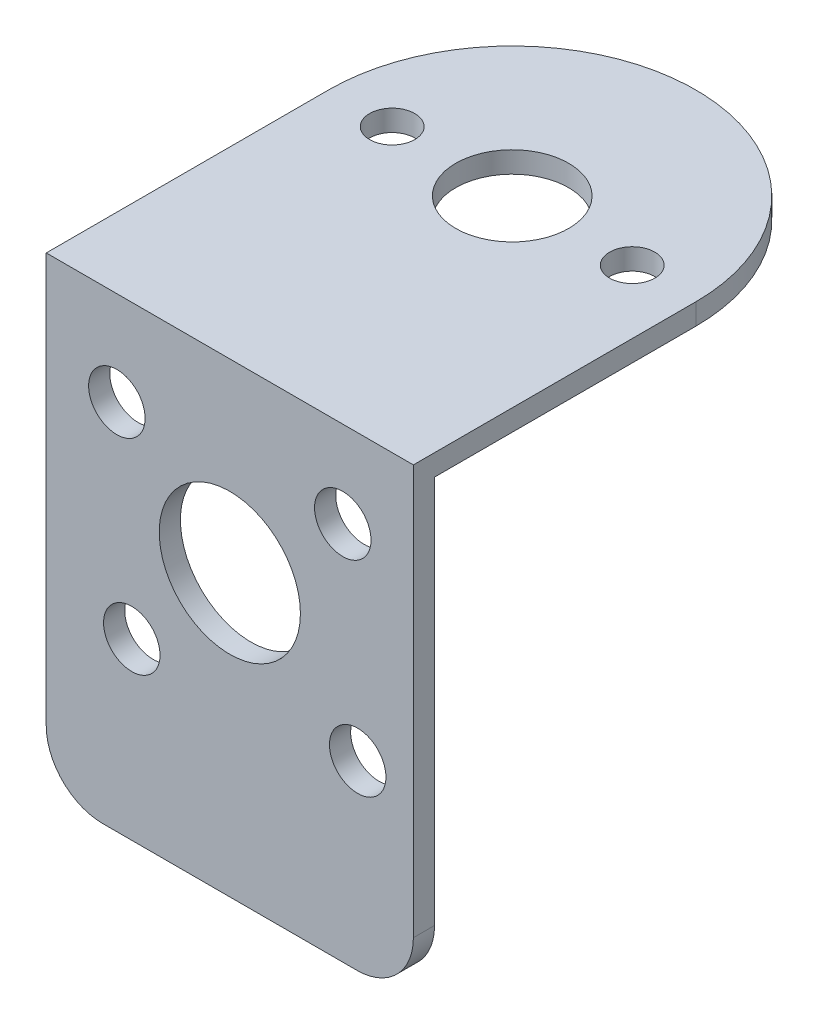
from build123d import *

# Parameters (mm, degrees)
SKETCH1_R           = 4
SKETCH1_R_2         = 1.6
BOSS_EXTRUDE1_DEPTH = 1.5
SKETCH2_R           = 5
SKETCH2_R_2         = 2
BOSS_EXTRUDE2_DEPTH = 1.5


with BuildPart() as part:
    # Sketch1 → Boss-Extrude1 (new body)
    with BuildSketch(Plane(origin=(0, 0, 0), x_dir=(1, 0, 0), z_dir=(0, 1, 0))):
        with BuildLine():
            Line((-13, -20), (-13, 0))
            ThreePointArc((-13, 0), (0, 13), (13, 0))
            Line((13, 0), (13, -20))
            Line((13, -20), (-13, -20))
        make_face()
        with Locations(Location((0, 0, 0), (0, 0, 270))):
            Circle(SKETCH1_R, mode=Mode.SUBTRACT)
        with Locations(Location((8.5, 0, 0), (0, 0, 270))):
            Circle(SKETCH1_R_2, mode=Mode.SUBTRACT)
        with Locations(Location((-8.5, 0, 0), (0, 0, 270))):
            Circle(SKETCH1_R_2, mode=Mode.SUBTRACT)
    extrude(amount=-BOSS_EXTRUDE1_DEPTH)

    # Sketch2 → Boss-Extrude2 (add)
    with BuildSketch(Plane.XY.offset(20)):
        with BuildLine():
            Line((13, -1.5), (13, -29))
            ThreePointArc((13, -29), (11.828427125, -31.828427125), (9, -33))
            Line((9, -33), (-9, -33))
            ThreePointArc((-9, -33), (-11.828427125, -31.828427125), (-13, -29))
            Line((-13, -29), (-13, -1.5))
            Line((-13, -1.5), (13, -1.5))
        make_face()
        with Locations((0, -13.122230355)):
            Circle(SKETCH2_R, mode=Mode.SUBTRACT)
        with Locations((8, -6.122230355)):
            Circle(SKETCH2_R_2, mode=Mode.SUBTRACT)
        with Locations((-8, -6.647631856)):
            Circle(SKETCH2_R_2, mode=Mode.SUBTRACT)
        with Locations((-6.942675301, -20.647631856)):
            Circle(SKETCH2_R_2, mode=Mode.SUBTRACT)
        with Locations((9.057324699, -20.122230355)):
            Circle(SKETCH2_R_2, mode=Mode.SUBTRACT)
    extrude(amount=-BOSS_EXTRUDE2_DEPTH)


solid = part.part
